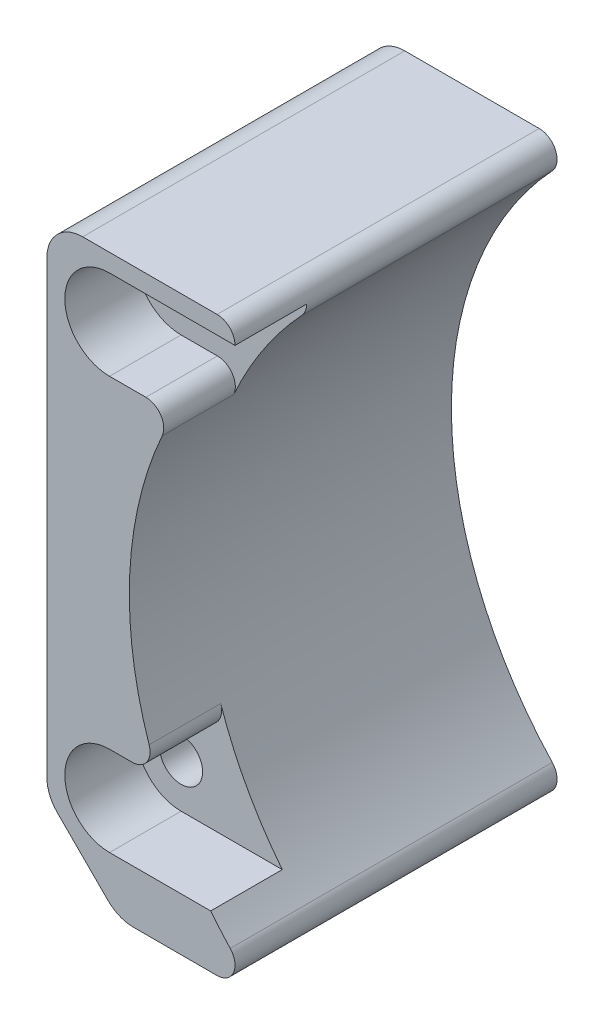
from build123d import *

# Parameters (mm, degrees)
BOSS_EXTRUDE1_DEPTH = 28.575
CHAMFER1_SIZE       = 6.35
SKETCH3_R           = 1.905
CUT_EXTRUDE1_DEPTH  = 62.321512782
FILLET1_R           = 3.175
CUT_EXTRUDE4_START  = -6.35
CUT_EXTRUDE4_DEPTH  = 6.35
FILLET3_R           = 1.5875
FILLET5_R           = 1.5875


with BuildPart() as part:
    # Sketch2 → Boss-Extrude1 (new body)
    with BuildSketch(Plane.XY):
        with BuildLine():
            Line((0, 0), (19.056686619, 0))
            ThreePointArc((19.056686619, 0), (7.311521051, 25.4), (19.056686619, 50.8))
            Line((19.056686619, 50.8), (0, 50.8))
            Line((0, 50.8), (0, 0))
        make_face()
    extrude(amount=BOSS_EXTRUDE1_DEPTH)

    # Chamfer1
    chamfer1_edges = [part.edges().sort_by_distance(p)[0] for p in [
        (0, 0, 14.2875),
    ]]
    chamfer(chamfer1_edges, length=CHAMFER1_SIZE)

    # Sketch3 → Cut-Extrude1 (cut, through all)
    with BuildSketch(Plane.XY.offset(28.575)):
        with Locations((5.55625, 45.24375)):
            Circle(SKETCH3_R)
        with Locations((5.55625, 8.651474106)):
            Circle(SKETCH3_R)
    extrude(amount=-CUT_EXTRUDE1_DEPTH, mode=Mode.SUBTRACT)

    # Fillet1
    fillet1_edges = [part.edges().sort_by_distance(p)[0] for p in [
        (0, 50.8, 14.2875),
        (6.35, 0, 14.2875),
        (0, 6.35, 14.2875),
    ]]
    fillet(fillet1_edges, radius=FILLET1_R)

    # Sketch6 → Cut-Extrude4 (cut)
    with BuildSketch(Plane.XY.offset(28.575).offset(CUT_EXTRUDE4_START)):
        with BuildLine():
            Line((5.55625, 49.2125), (17.317631251, 49.2125))
            ThreePointArc((17.317631251, 49.2125), (14.028288765, 45.468022294), (11.333951868, 41.275))
            Line((11.333951868, 41.275), (5.55625, 41.275))
            ThreePointArc((5.55625, 41.275), (1.5875, 45.24375), (5.55625, 49.2125))
        make_face()
        with BuildLine():
            Line((5.55625, 12.620224106), (9.858336838, 12.620224106))
            ThreePointArc((9.858336838, 12.620224106), (11.918918568, 8.489348991), (14.530380471, 4.682724106))
            Line((14.530380471, 4.682724106), (5.55625, 4.682724106))
            ThreePointArc((5.55625, 4.682724106), (1.5875, 8.651474106), (5.55625, 12.620224106))
        make_face()
    extrude(amount=CUT_EXTRUDE4_DEPTH, mode=Mode.SUBTRACT)

    # Fillet3
    fillet3_edges = [part.edges().sort_by_distance(p)[0] for p in [
        (19.056686619, 0, 14.2875),
        (19.056686619, 50.8, 14.2875),
    ]]
    fillet(fillet3_edges, radius=FILLET3_R)

    # Fillet5
    fillet5_edges = [part.edges().sort_by_distance(p)[0] for p in [
        (11.333951868, 41.275, 25.4),
        (9.858336838, 12.620224106, 25.4),
    ]]
    fillet(fillet5_edges, radius=FILLET5_R)


solid = part.part
